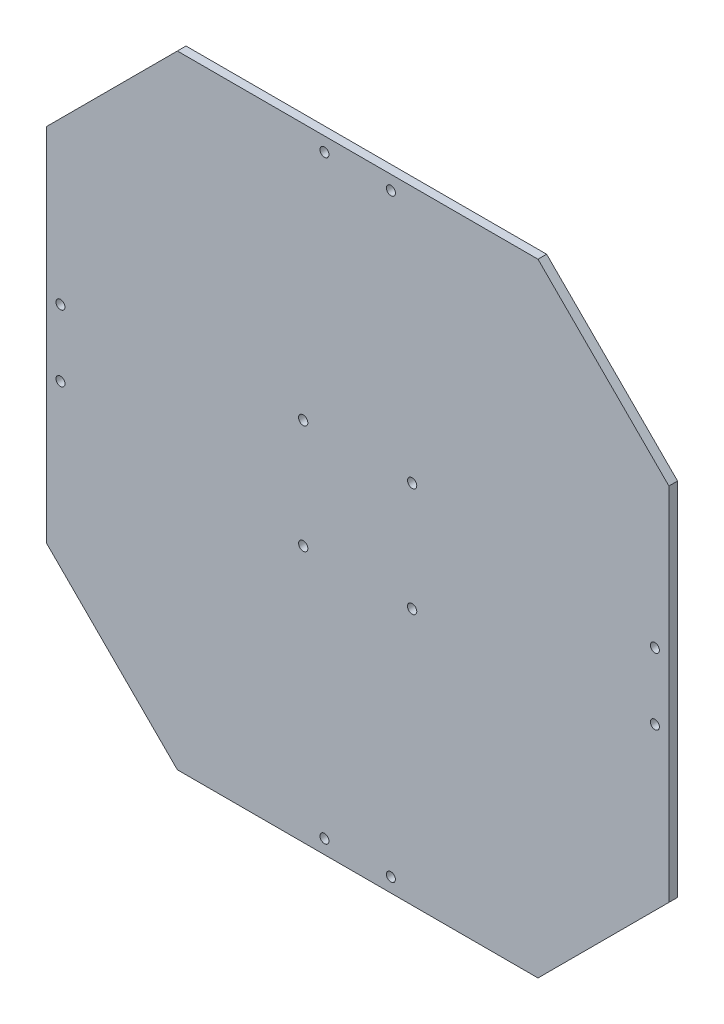
from build123d import *

# Parameters (mm, degrees)
BOSS_EXTRUDE1_DEPTH  = 3.175
M3_CLEARANCE_HOLE1_D = 3.4
SKETCH6_R            = 1.651
CUT_EXTRUDE1_DEPTH   = 3.175


with BuildPart() as part:
    # Sketch1 → Boss-Extrude1 (new body)
    with BuildSketch(Plane.XY):
        Polygon((-88.939961868, 77.031330301), (-40.856700747, 28.948069181), (91.576777011, 28.948069181), (139.660038132, 77.031330301), (139.660038132, 209.46480806), (91.576777011, 257.548069181), (-40.856700747, 257.548069181), (-88.939961868, 209.46480806), align=None)
    extrude(amount=BOSS_EXTRUDE1_DEPTH)

    # M3 Clearance Hole1 (through all)
    with Locations(Plane.XY.offset(3.175)):
        with Locations((5.360038132, 163.248069181), (45.360038132, 123.248069181), (45.360038132, 163.248069181), (5.360038132, 123.248069181)):
            Hole(M3_CLEARANCE_HOLE1_D / 2)

    # Sketch6 → Cut-Extrude1 (cut)
    with BuildSketch(Plane.XY.offset(3.175)):
        with Locations((37.560038132, 252.391869181)):
            Circle(SKETCH6_R)
        with Locations((13.160038132, 252.391869181)):
            Circle(SKETCH6_R)
        with Locations((-83.783761868, 155.448069181)):
            Circle(SKETCH6_R)
        with Locations((-83.783761868, 131.048069181)):
            Circle(SKETCH6_R)
        with Locations((13.160038132, 34.104269181)):
            Circle(SKETCH6_R)
        with Locations((37.560038132, 34.104269181)):
            Circle(SKETCH6_R)
        with Locations((134.503838132, 131.048069181)):
            Circle(SKETCH6_R)
        with Locations((134.503838132, 155.448069181)):
            Circle(SKETCH6_R)
    extrude(amount=-CUT_EXTRUDE1_DEPTH, mode=Mode.SUBTRACT)


solid = part.part
